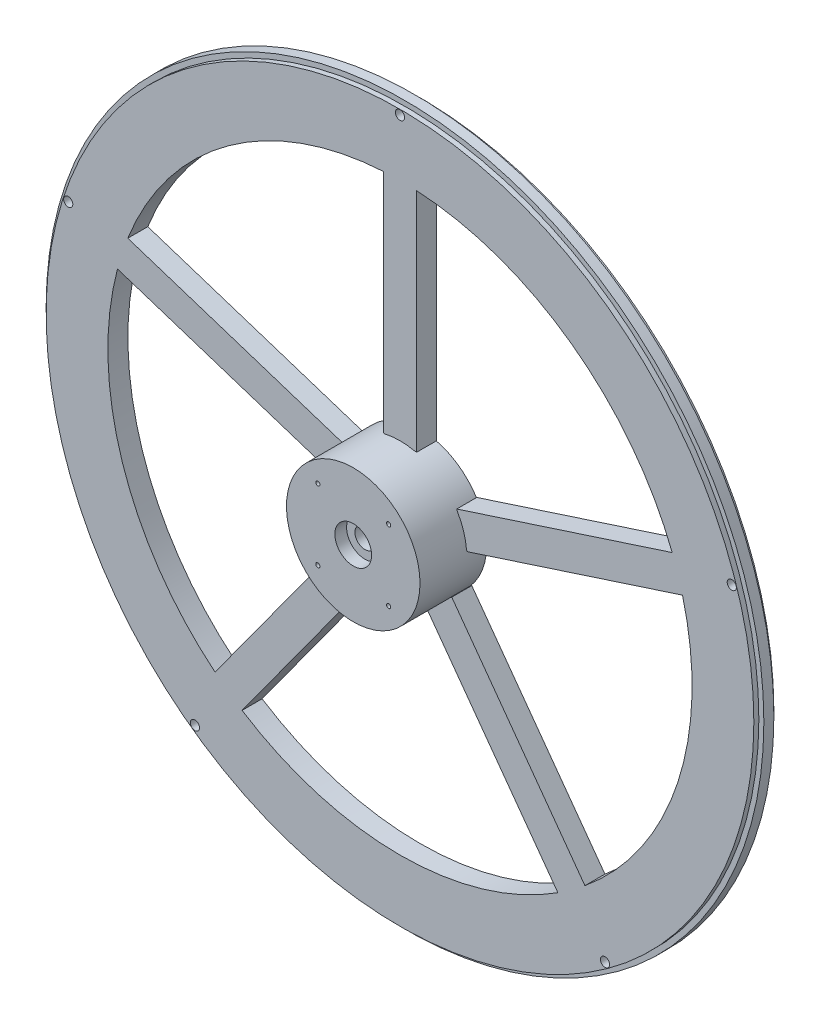
from build123d import *

# Parameters (mm, degrees)
SKETCH1_R               = 215
SKETCH1_R_2             = 175
RING_DEPTH              = 12
SKETCH2_R               = 40
HUB_DEPTH               = 40
SKETCH3_W               = 20
SKETCH3_H               = 137
SPOKES_DEPTH            = 12
SKETCH4_R               = 6
BORE_DEPTH              = 40
SKETCH5_R               = 11
BEARING_SEAT_LOW_DEPTH  = 7
SKETCH6_R               = 11
BEARING_SEAT_HIGH_DEPTH = 7
SKETCH7_R               = 216
SKETCH7_R_2             = 212
BAND_RABBET_DEPTH       = 3
SKETCH8_R               = 216
SKETCH8_R_2             = 212
COVER_RABBET_DEPTH      = 3
SKETCH9_R               = 2.75
ROD_HOLES_DEPTH         = 12
SKETCH10_R              = 1.25
GROMMET_SCREWS_DEPTH    = 8


with BuildPart() as part:
    # Sketch1 → Ring (new body)
    with BuildSketch(Plane.XY):
        Circle(SKETCH1_R)
        Circle(SKETCH1_R_2, mode=Mode.SUBTRACT)
    extrude(amount=RING_DEPTH)



with BuildPart() as body_2:
    # Sketch2 → Hub (new body)
    with BuildSketch(Plane.XY):
        Circle(SKETCH2_R)
    extrude(amount=HUB_DEPTH)


with BuildPart() as part_1:
    add(part.part)

    add(body_2.part)  # Spokes merges body 2
    # Sketch3 → Spokes (add)
    with BuildSketch(Plane.XY):
        Polygon((40.181374079, 2.541097618), (170.476116812, 44.876425847), (164.295776924, 63.897556173), (34.001034192, 21.562227944), align=None)
        with Locations((0, 107.5)):
            Rectangle(SKETCH3_W, SKETCH3_H)
        Polygon((-34.001034192, 21.562227944), (-164.295776924, 63.897556173), (-170.476116812, 44.876425847), (-40.181374079, 2.541097618), align=None)
        Polygon((-31.013794783, -25.673810258), (-111.540374347, -136.509138487), (-95.36003446, -148.264843533), (-14.833454896, -37.429515304), align=None)
        Polygon((14.833454896, -37.429515304), (95.36003446, -148.264843533), (111.540374347, -136.509138487), (31.013794783, -25.673810258), align=None)
    extrude(amount=SPOKES_DEPTH)

    # Sketch4 → Bore (cut)
    with BuildSketch(Plane.XY):
        Circle(SKETCH4_R)
    extrude(amount=BORE_DEPTH, mode=Mode.SUBTRACT)

    # Sketch5 → Bearing_seat_low (cut)
    with BuildSketch(Plane.XY):
        Circle(SKETCH5_R)
    extrude(amount=BEARING_SEAT_LOW_DEPTH, mode=Mode.SUBTRACT)

    # Sketch6 → Bearing_seat_high (cut)
    with BuildSketch(Plane.XY.offset(33)):
        Circle(SKETCH6_R)
    extrude(amount=BEARING_SEAT_HIGH_DEPTH, mode=Mode.SUBTRACT)

    # Sketch7 → Band_rabbet (cut)
    with BuildSketch(Plane.XY):
        Circle(SKETCH7_R)
        Circle(SKETCH7_R_2, mode=Mode.SUBTRACT)
    extrude(amount=BAND_RABBET_DEPTH, mode=Mode.SUBTRACT)

    # Sketch8 → Cover_rabbet (cut)
    with BuildSketch(Plane.XY.offset(9)):
        Circle(SKETCH8_R)
        Circle(SKETCH8_R_2, mode=Mode.SUBTRACT)
    extrude(amount=COVER_RABBET_DEPTH, mode=Mode.SUBTRACT)

    # Sketch9 → Rod_holes (cut)
    with BuildSketch(Plane.XY):
        with Locations((198.770811906, 64.584551824)):
            Circle(SKETCH9_R)
        with Locations((0, 209)):
            Circle(SKETCH9_R)
        with Locations((-198.770811906, 64.584551824)):
            Circle(SKETCH9_R)
        with Locations((-122.847117729, -169.084551824)):
            Circle(SKETCH9_R)
        with Locations((122.847117729, -169.084551824)):
            Circle(SKETCH9_R)
    extrude(amount=ROD_HOLES_DEPTH, mode=Mode.SUBTRACT)

    # Sketch10 → Grommet_screws (cut)
    with BuildSketch(Plane.XY.offset(32)):
        with Locations((21.213203436, 21.213203436)):
            Circle(SKETCH10_R)
        with Locations((-21.213203436, 21.213203436)):
            Circle(SKETCH10_R)
        with Locations((-21.213203436, -21.213203436)):
            Circle(SKETCH10_R)
        with Locations((21.213203436, -21.213203436)):
            Circle(SKETCH10_R)
    extrude(amount=GROMMET_SCREWS_DEPTH, mode=Mode.SUBTRACT)


solid = part_1.part
